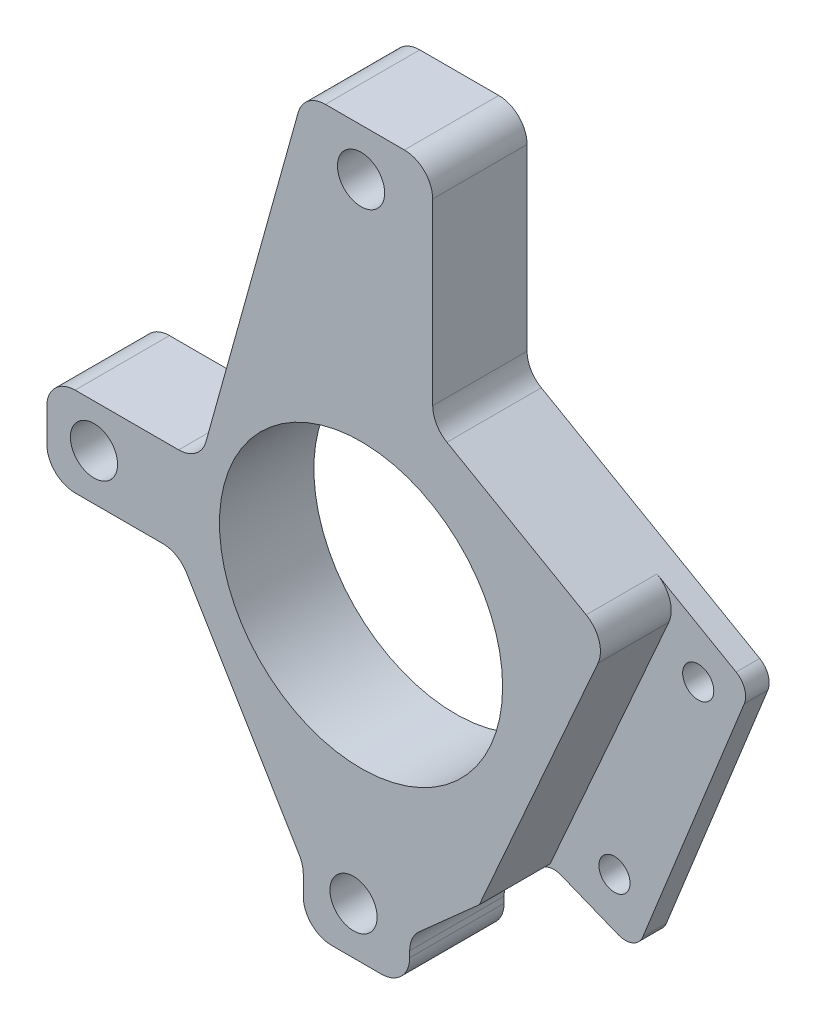
from build123d import *

# Parameters (mm, degrees)
SKETCH1_R           = 38.1
SKETCH1_R_2         = 6.35
BOSS_EXTRUDE1_DEPTH = 25.4
CUT_EXTRUDE1_DEPTH  = 19.05
SKETCH3_R           = 4.191
CUT_EXTRUDE2_DEPTH  = 144.195909909
FILLET1_R           = 7.62
FILLET2_R           = 5.08


with BuildPart() as part:
    # Sketch1 → Boss-Extrude1 (new body)
    with BuildSketch(Plane.XY):
        Polygon((-15.376904817, 111.859177573), (19.281255226, 111.859177573), (19.281255226, 51.662487547), (85.717168685, 13.57632424), (54.880053148, -63.203130515), (31.826573213, -53.944106385), (13.090387594, -70.609161185), (13.090387594, -83.309161185), (-15.546461726, -83.309161185), (-15.546461726, -68.356164498), (-49.113541671, -12.382140744), (-84.5631354, -12.382140744), (-84.5631354, 11.598068918), (-43.284636092, 11.598068918), align=None)
        Circle(SKETCH1_R, mode=Mode.SUBTRACT)
        with Locations((0, 99.159177573)):
            Circle(SKETCH1_R_2, mode=Mode.SUBTRACT)
        with Locations((-2.02148369, -70.609161185)):
            Circle(SKETCH1_R_2, mode=Mode.SUBTRACT)
        with Locations((-71.8631354, 0)):
            Circle(SKETCH1_R_2, mode=Mode.SUBTRACT)
    extrude(amount=BOSS_EXTRUDE1_DEPTH)

    # Sketch2 → Cut-Extrude1 (cut)
    with BuildSketch(Plane.XY.offset(25.4)):
        Polygon((445.884060036, -192.898973947), (85.717168685, 13.57632424), (66.538177491, 24.571193621), (31.826573213, -53.944106385), (-136.039422118, -433.645628635), (181.37430947, -1200.885797388), (763.297791624, -960.1391427), align=None)
    extrude(amount=-CUT_EXTRUDE1_DEPTH, mode=Mode.SUBTRACT)

    # Sketch3 → Cut-Extrude2 (cut, through all)
    with BuildSketch(Plane.XY.offset(25.4)):
        with Locations((71.679164996, 8.361848351)):
            Circle(SKETCH3_R)
        with Locations((49.148937242, -47.734792738)):
            Circle(SKETCH3_R)
    extrude(amount=-CUT_EXTRUDE2_DEPTH, mode=Mode.SUBTRACT)

    # Fillet1
    fillet1_edges = [part.edges().sort_by_distance(p)[0] for p in [
        (13.090387594, -70.609161185, 12.7),
        (13.090387594, -83.309161185, 12.7),
        (-15.546461726, -83.309161185, 12.7),
        (-15.546461726, -68.356164498, 12.7),
        (-49.113541671, -12.382140744, 12.7),
        (-84.5631354, -12.382140744, 12.7),
        (-84.5631354, 11.598068918, 12.7),
        (-43.284636092, 11.598068918, 12.7),
        (-15.376904817, 111.859177573, 12.7),
        (19.281255226, 111.859177573, 12.7),
        (19.281255226, 51.662487547, 12.7),
        (66.538177491, 24.571193621, 15.875),
    ]]
    fillet(fillet1_edges, radius=FILLET1_R)

    # Fillet2
    fillet2_edges = [part.edges().sort_by_distance(p)[0] for p in [
        (85.717168685, 13.57632424, 3.175),
        (54.880053148, -63.203130515, 3.175),
        (31.826573213, -53.944106385, 3.175),
    ]]
    fillet(fillet2_edges, radius=FILLET2_R)


solid = part.part
